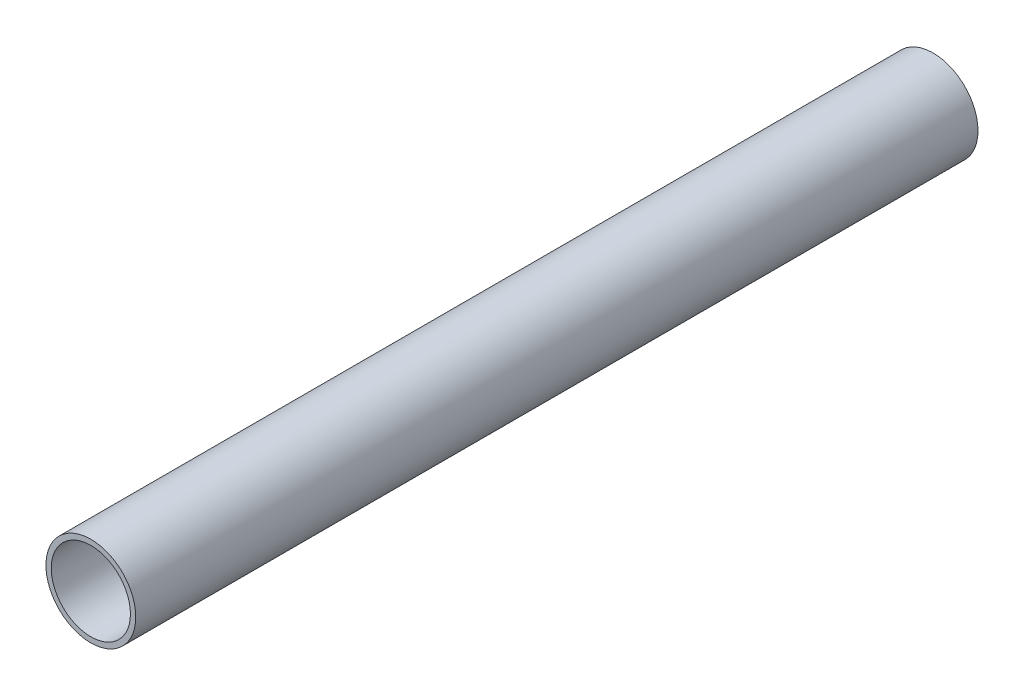
from build123d import *

# Parameters (mm, degrees)
PIPESKETCH_R    = 16
PIPESKETCH_R_2  = 14.1
EXTRUSION_DEPTH = 300


with BuildPart() as part:
    # PipeSketch → Extrusion (new body)
    with BuildSketch(Plane.XY):
        Circle(PIPESKETCH_R)
        Circle(PIPESKETCH_R_2, mode=Mode.SUBTRACT)
    extrude(amount=EXTRUSION_DEPTH)


solid = part.part
